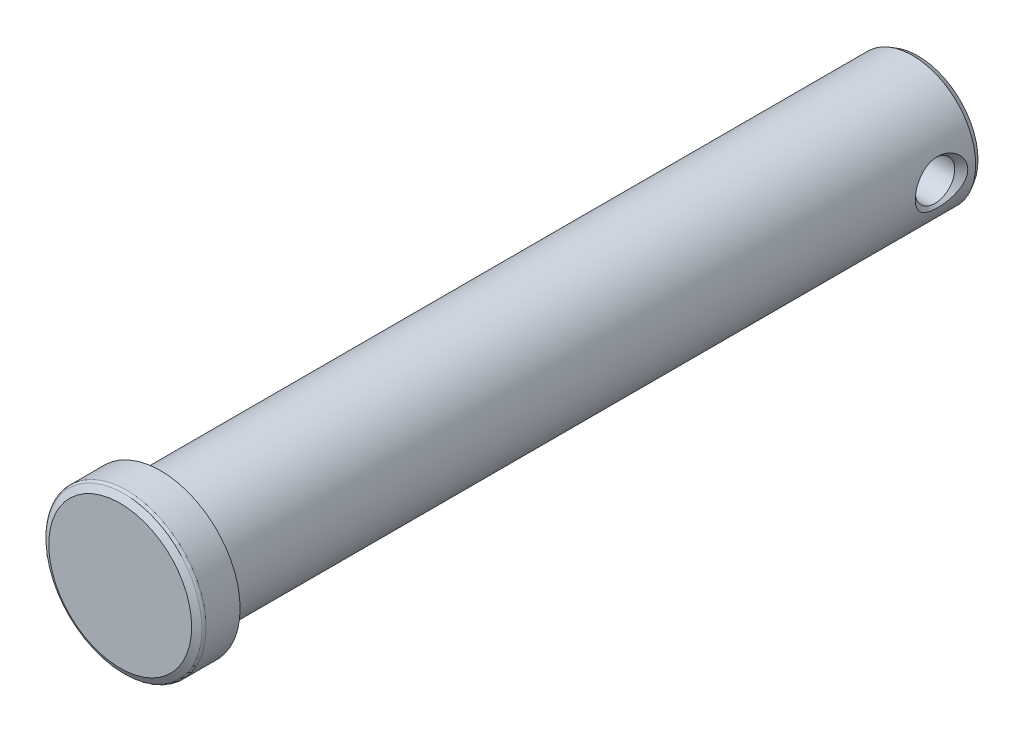
from build123d import *

# Parameters (mm, degrees)
CUT_EXTRUDE1_DEPTH      = 44.655868998
CUT_EXTRUDE1_DEPTH_BACK = 44.655868998
SKETCH3_R               = 1.9812
FILLET1_R               = 0.3175


with BuildPart() as part:
    # Sketch2 → Revolve1 (revolve)
    with BuildSketch(Plane(origin=(0, 0, 0), x_dir=(0, 0, -1), z_dir=(1, 0, 0)), mode=Mode.PRIVATE) as revolve1_sk:
        Polygon((38.1, 6.0325), (38.1, 0), (-42.164, 0), (-42.164, 7.1882), (-41.694729701, 8.001), (-38.1, 8.001), (-38.1, 6.35), (37.550073869, 6.35), align=None)
    revolve(revolve1_sk.sketch.rotate(Axis((0, 0, 38.1), (0, 0, -1)), 90), axis=Axis((0, 0, 38.1), (0, 0, -1)))

    # Sketch3 → Cut-Extrude1 (cut, two sides: drawn at the far end of the back side and taken through both)
    with BuildSketch(Plane(origin=(0, 0, 0), x_dir=(0, 0, -1), z_dir=(1, 0, 0)).offset(-CUT_EXTRUDE1_DEPTH_BACK)):
        with Locations((34.1122, 0)):
            Circle(SKETCH3_R)
    extrude(amount=CUT_EXTRUDE1_DEPTH + CUT_EXTRUDE1_DEPTH_BACK, mode=Mode.SUBTRACT)

    # Fillet1
    fillet1_edges = [part.edges().sort_by_distance(p)[0] for p in [
        (-8.001, 0, 41.694729701),
        (-6.35, 0, 38.1),
    ]]
    fillet(fillet1_edges, radius=FILLET1_R)

    # Sketch4 → Cut-Revolve1 (revolve, cut)
    with BuildSketch(Plane(origin=(0, 0, 0), x_dir=(1, 0, 0), z_dir=(0, 1, 0)), mode=Mode.PRIVATE) as cut_revolve1_sk:
        Polygon((6.35, 34.1122), (6.35, 31.4706), (3.7084, 34.1122), align=None)
        Polygon((-6.35, 31.4706), (-3.7084, 34.1122), (-6.35, 34.1122), align=None)
    revolve(cut_revolve1_sk.sketch.rotate(Axis((6.35, 0, -34.1122), (-1, 0, 0)), 180), axis=Axis((6.35, 0, -34.1122), (-1, 0, 0)), mode=Mode.SUBTRACT)


solid = part.part
